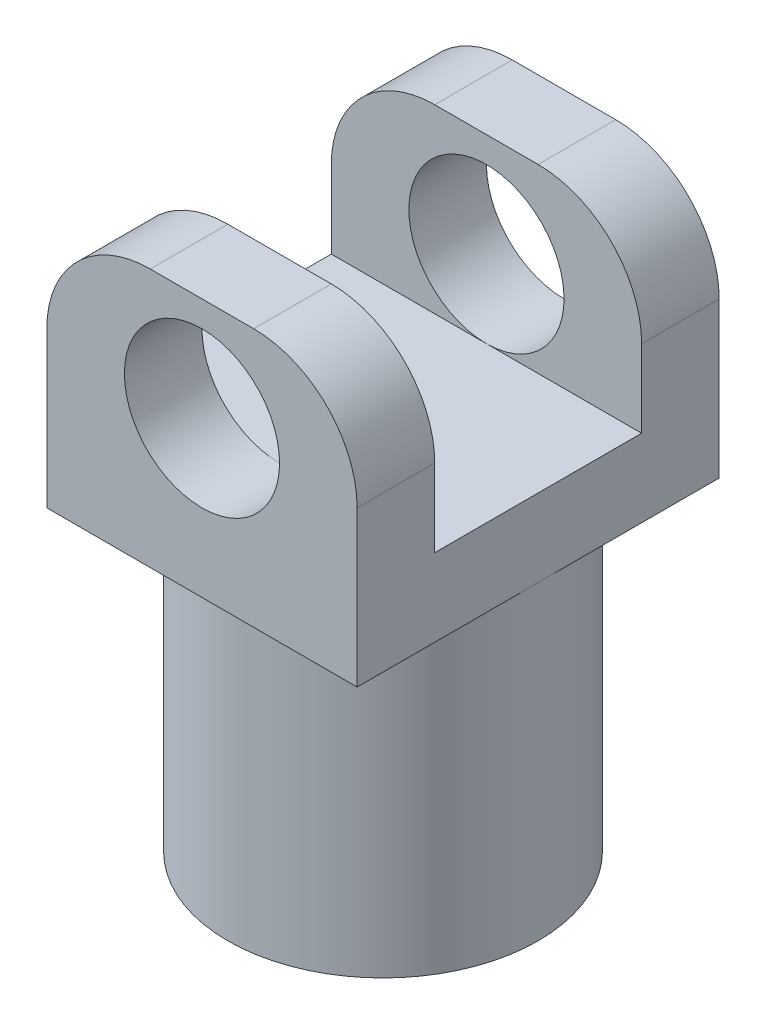
from build123d import *

# Parameters (mm, degrees)
SKETCH1_R           = 7.5
BOSS_EXTRUDE1_DEPTH = 35
SKETCH2_W           = 20
SKETCH2_H           = 17.5
CUT_EXTRUDE1_DEPTH  = 50
SKETCH4_R           = 15
BOSS_EXTRUDE2_DEPTH = 30
SKETCH6_R           = 9.525
CUT_EXTRUDE2_DEPTH  = 30


with BuildPart() as part:
    # Sketch1 → Boss-Extrude1 (new body)
    with BuildSketch(Plane.XY):
        with BuildLine():
            Line((-5, 12.5), (5, 12.5))
            ThreePointArc((5, 12.5), (12.071067812, 9.571067812), (15, 2.5))
            Line((15, 2.5), (15, -12.5))
            Line((15, -12.5), (-15, -12.5))
            Line((-15, -12.5), (-15, 2.5))
            ThreePointArc((-15, 2.5), (-12.071067812, 9.571067812), (-5, 12.5))
        make_face()
        with Locations((0, 2.5)):
            Circle(SKETCH1_R, mode=Mode.SUBTRACT)
    extrude(amount=BOSS_EXTRUDE1_DEPTH)

    # Sketch2 → Cut-Extrude1 (cut)
    with BuildSketch(Plane(origin=(15, 0, 0), x_dir=(0, 0, -1), z_dir=(1, 0, 0))):
        with Locations((-17.5, 3.75)):
            Rectangle(SKETCH2_W, SKETCH2_H)
    extrude(amount=-CUT_EXTRUDE1_DEPTH, mode=Mode.SUBTRACT)

    # Sketch4 → Boss-Extrude2 (add)
    with BuildSketch(Plane.XZ.offset(12.5)):
        with Locations(Location((0, 17.5, 0), (0, 0, 180))):
            Circle(SKETCH4_R)
    extrude(amount=BOSS_EXTRUDE2_DEPTH)

    # Sketch6 → Cut-Extrude2 (cut)
    with BuildSketch(Plane.XZ.offset(42.5)):
        with Locations(Location((0, 17.5, 0), (0, 0, 270))):
            Circle(SKETCH6_R)
    extrude(amount=-CUT_EXTRUDE2_DEPTH, mode=Mode.SUBTRACT)


solid = part.part
